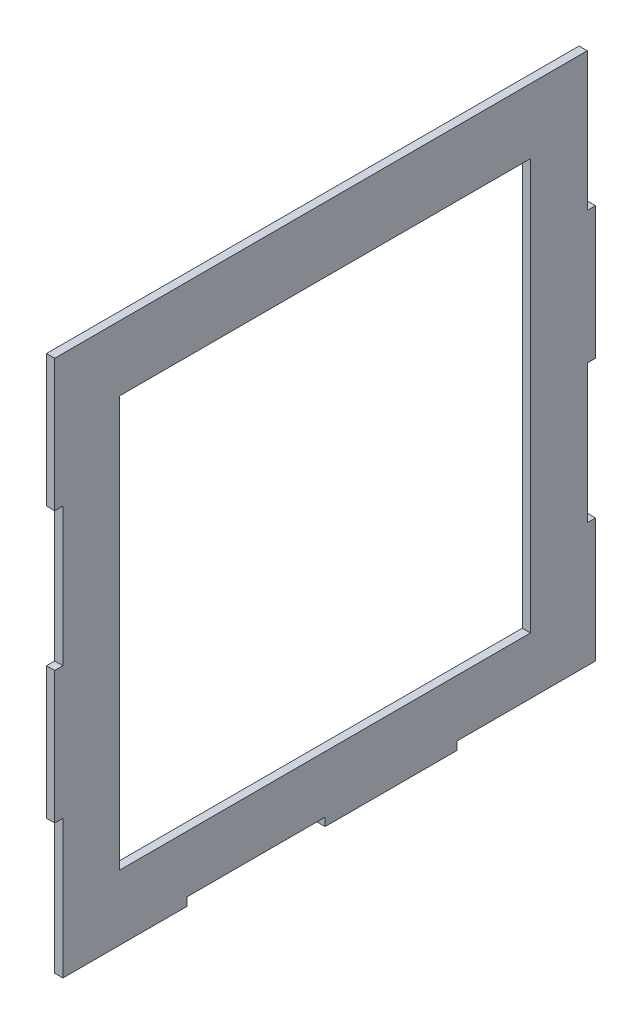
from build123d import *

# Parameters (mm, degrees)
SKETCH2_W           = 300
SKETCH2_H           = 300
BOSS_EXTRUDE2_DEPTH = 6


with BuildPart() as part:
    # Sketch2 → Boss-Extrude2 (new body)
    with BuildSketch(Plane(origin=(0, 0, 0), x_dir=(0, 0, -1), z_dir=(1, 0, 0))):
        Polygon((-191.5, -96.5), (-191.5, -197.5), (-101, -197.5), (-101, -191.5), (0, -191.5), (0, -197.5), (96.5, -197.5), (96.5, -191.5), (197.5, -191.5), (197.5, -101), (191.5, -101), (191.5, 0), (197.5, 0), (197.5, 96.5), (191.5, 96.5), (191.5, 197.5), (-197.5, 197.5), (-197.5, 101), (-191.5, 101), (-191.5, 0), (-197.5, 0), (-197.5, -96.5), align=None)
        Rectangle(SKETCH2_W, SKETCH2_H, mode=Mode.SUBTRACT)
    extrude(amount=BOSS_EXTRUDE2_DEPTH)


solid = part.part
